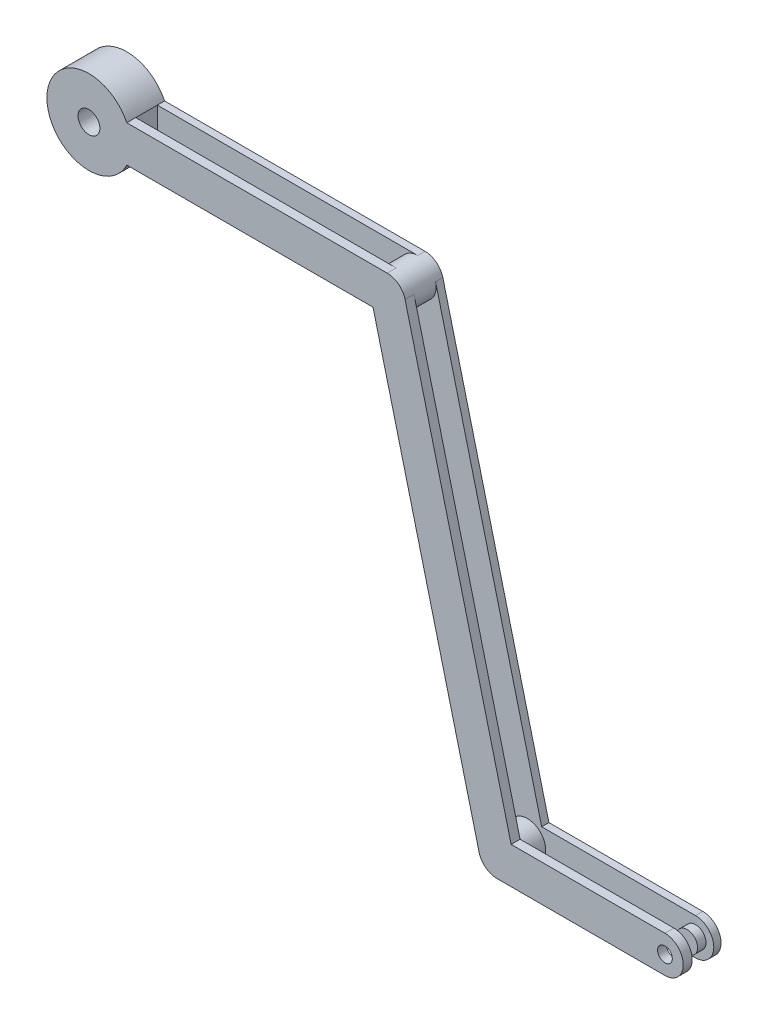
from build123d import *
from build123d.topology import SkipClean

# Parameters (mm, degrees)
EXTRUDE_1_DEPTH     = 9
SKETCH_2_R          = 5.6
CUT_EXTRUDE_1_DEPTH = 4.6
SKETCH_3_R          = 2.6
CUT_EXTRUDE_2_DEPTH = 178.798114195
SKETCH_5_W          = 132.43986789
SKETCH_5_H          = 5.139725872
CUT_EXTRUDE_3_DEPTH = 181.463576917
EXTRUDE_START       = -7.270147681
SKETCH_6_R          = 4.358898944
EXTRUDE_2_DEPTH     = 7.270147681
SKETCH_7_R          = 4.358898944
EXTRUDE_3_DEPTH     = 7.270147681
SKETCH_8_R          = 2.5
EXTRUDE_4_DEPTH     = 2
CUT_EXTRUDE_4_REACH = 179.798
SKETCH_9_R          = 1.75


with BuildPart() as part:
    # 草图1 → 凸台-拉伸1 (new body)
    with BuildSketch(Plane.XY):
        with BuildLine():
            Line((97.080968947, -107.358898944), (137.080968947, -107.358898944))
            ThreePointArc((137.080968947, -107.358898944), (141.43986789, -103), (137.080968947, -98.641101056))
            Line((137.080968947, -98.641101056), (100.473705575, -98.641101056))
            Line((100.473705575, -98.641101056), (75.225539013, 1.069962639))
            ThreePointArc((75.225539013, 1.069962639), (73.67732525, 3.439757187), (71, 4.358898944))
            Line((71, 4.358898944), (9, 4.358898944))
            ThreePointArc((9, 4.358898944), (-10, 0), (9, -4.358898944))
            Line((9, -4.358898944), (67.607263372, -4.358898944))
            Line((67.607263372, -4.358898944), (92.855429934, -104.069962639))
            ThreePointArc((92.855429934, -104.069962639), (94.403643697, -106.439757187), (97.080968947, -107.358898944))
        make_face()
    extrude(amount=EXTRUDE_1_DEPTH)

    # 草图2 → 切除-拉伸1 (cut)
    with BuildSketch(Plane(origin=(0, 0, 0), x_dir=(-1, 0, 0), z_dir=(0, 0, -1))):
        Circle(SKETCH_2_R)
    extrude(amount=-CUT_EXTRUDE_1_DEPTH, mode=Mode.SUBTRACT)

    # 草图3 → 切除-拉伸2 (cut, through all)
    with BuildSketch(Plane.XY.offset(9)):
        Circle(SKETCH_3_R)
    extrude(amount=-CUT_EXTRUDE_2_DEPTH, mode=Mode.SUBTRACT)

    # 草图5 → 切除-拉伸3 (cut, through all)
    with BuildSketch(Plane(origin=(0, 4.358898944, 0), x_dir=(1, 0, 0), z_dir=(0, 1, 0))):
        with Locations((75.219933945, -4.299715255)):
            Rectangle(SKETCH_5_W, SKETCH_5_H)
    extrude(amount=-CUT_EXTRUDE_3_DEPTH, mode=Mode.SUBTRACT)

    # 草图6 → 凸台-拉伸2 (add)
    with SkipClean():  # the faces are left unmerged after this step: merging them gives an invalid solid
        with BuildSketch(Plane.XY.offset(9).offset(EXTRUDE_START)):
            with Locations(Location((71, 0, 0), (0, 0, 90))):
                Circle(SKETCH_6_R)
        extrude(amount=EXTRUDE_2_DEPTH)

    # 草图7 → 凸台-拉伸3 (add)
    with SkipClean():  # the faces are left unmerged after this step: merging them gives an invalid solid
        with BuildSketch(Plane.XY.offset(9).offset(EXTRUDE_START)):
            with Locations(Location((97.080968947, -103, 0), (0, 0, 194.209390146))):
                Circle(SKETCH_7_R)
        extrude(amount=EXTRUDE_3_DEPTH)

    # 草图8 → 凸台-拉伸4 (add)
    with SkipClean():  # the faces are left unmerged after this step: merging them gives an invalid solid
        with BuildSketch(Plane.XY.offset(1.729852319)):
            with Locations(Location((137.080968947, -103, 0), (0, 0, 180))):
                Circle(SKETCH_8_R)
        extrude(amount=EXTRUDE_4_DEPTH)

    # 草图9 → 切除-拉伸4 (cut, up to next)
    with BuildSketch(Plane.XY.offset(9), mode=Mode.PRIVATE) as cut_extrude_4_sk1:
        with Locations((137.080968947, -103)):
            Circle(SKETCH_9_R)
    cut_extrude_4_tool1 = extrude(cut_extrude_4_sk1.sketch, amount=-CUT_EXTRUDE_4_REACH, mode=Mode.PRIVATE) & part.part
    add(cut_extrude_4_tool1.solids().sort_by_distance((137.080969, -103, 9))[0], mode=Mode.SUBTRACT)


solid = part.part
